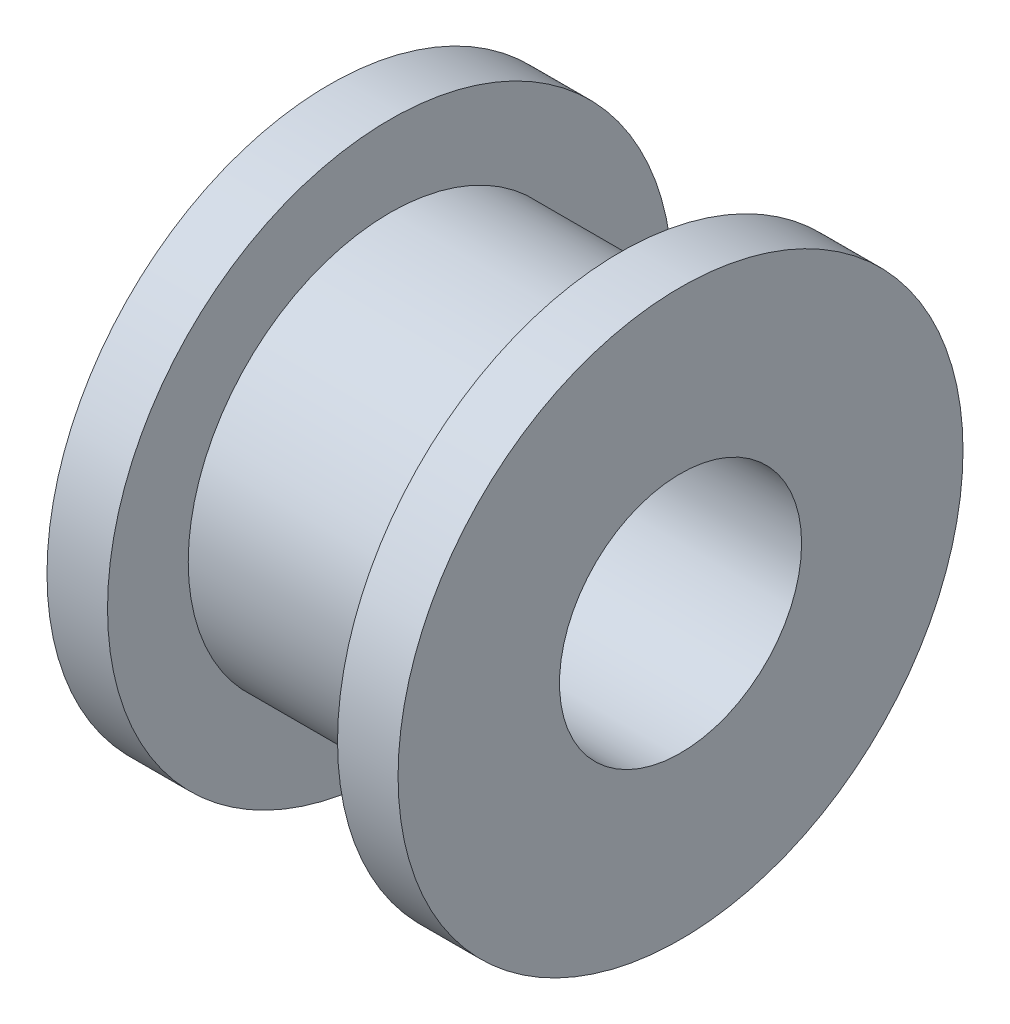
from build123d import *

# Parameters (mm, degrees)
SKETCH_1_R          = 5
EXTRUDE_1_DEPTH     = 8.7
SKETCH_2_R          = 7
EXTRUDE_2_DEPTH     = 1.5
EXTRUDE_START       = -1.5
SKETCH_3_R          = 7
EXTRUDE_3_DEPTH     = 1.5
SKETCH_4_R          = 3
CUT_EXTRUDE_1_DEPTH = 10


with BuildPart() as part:
    # 草图1 → 凸台-拉伸1 (new body)
    with BuildSketch(Plane(origin=(0, 0, 0), x_dir=(0, 0, -1), z_dir=(1, 0, 0))):
        Circle(SKETCH_1_R)
    extrude(amount=EXTRUDE_1_DEPTH)

    # 草图2 → 凸台-拉伸2 (add)
    with BuildSketch(Plane(origin=(8.7, 0, 0), x_dir=(0, 0, -1), z_dir=(1, 0, 0))):
        Circle(SKETCH_2_R)
    extrude(amount=-EXTRUDE_2_DEPTH)

    # 草图3 → 凸台-拉伸3 (add)
    with BuildSketch(Plane.ZY.offset(EXTRUDE_START)):
        with Locations(Location((0, 0, 0), (0, 0, 180))):
            Circle(SKETCH_3_R)
    extrude(amount=EXTRUDE_3_DEPTH)

    # 草图4 → 切除-拉伸1 (cut)
    with BuildSketch(Plane(origin=(8.7, 0, 0), x_dir=(0, 0, -1), z_dir=(1, 0, 0))):
        Circle(SKETCH_4_R)
    extrude(amount=-CUT_EXTRUDE_1_DEPTH, mode=Mode.SUBTRACT)


solid = part.part
